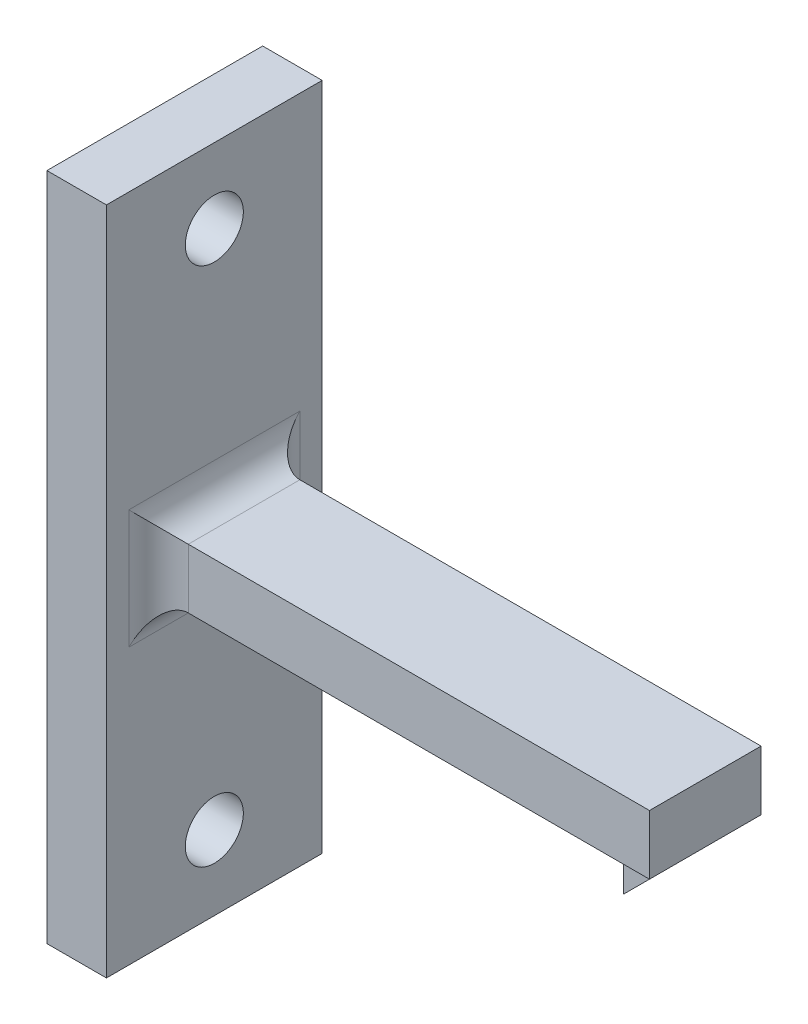
from build123d import *

# Parameters (mm, degrees)
BOSS_EXTRUDE1_DEPTH      = 1
BOSS_EXTRUDE1_DEPTH_BACK = 1
SKETCH2_R                = 2
SKETCH2_R_2              = 1
BOSS_EXTRUDE2_DEPTH      = 4
SKETCH4_R                = 1.07
CUT_EXTRUDE1_DEPTH       = 233.583689314
BOSS_EXTRUDE3_DEPTH      = 2
SKETCH8_W                = 4
SKETCH8_H                = 8
BOSS_EXTRUDE4_DEPTH      = 2
CUT_EXTRUDE2_DEPTH       = 2
SKETCH10_W               = 34.5
SKETCH10_H               = 4
BOSS_EXTRUDE5_DEPTH      = 2.75
SKETCH11_W               = 34.5
SKETCH11_H               = 4
BOSS_EXTRUDE6_DEPTH      = 2.75
BOSS_EXTRUDE7_DEPTH      = 0.5
BOSS_EXTRUDE8_DEPTH      = 0.5
SKETCH14_W               = 1.779922348
SKETCH14_H               = 4
BOSS_EXTRUDE9_DEPTH      = 7.5
CUT_EXTRUDE3_DEPTH       = 10
CUT_EXTRUDE3_DEPTH_BACK  = 2
SKETCH15_W               = 40
SKETCH15_H               = 27.31360861
SKETCH16_W               = 14.5
SKETCH16_H               = 45
BOSS_EXTRUDE10_DEPTH     = 4
SKETCH18_R               = 1.95
CUT_EXTRUDE4_DEPTH       = 4
FILLET1_R                = 2


with BuildPart() as part:
    # Sketch2 → Boss-Extrude1 (new, two sides: drawn at the far end of the back side and taken through both)
    # profile 1 of 2: a face of its own
    with BuildSketch(Plane.XY.offset(-2.5).offset(-BOSS_EXTRUDE1_DEPTH_BACK)):
        with BuildLine():
            ThreePointArc((230.02407749, -2), (228.02407749, 0), (230.02407749, 2))
            Line((230.02407749, 2), (225.02407749, 2))
            Line((225.02407749, 2), (225.02407749, -2))
            Line((225.02407749, -2), (230.02407749, -2))
        make_face()
    # profile 2 of 2: a face of its own
    with BuildSketch(Plane.XY.offset(-2.5).offset(-BOSS_EXTRUDE1_DEPTH_BACK)):
        with Locations((230.02407749, 0)):
            Circle(SKETCH2_R)
        with Locations((230.02407749, 0)):
            Circle(SKETCH2_R_2, mode=Mode.SUBTRACT)
    extrude(amount=BOSS_EXTRUDE1_DEPTH + BOSS_EXTRUDE1_DEPTH_BACK)

    # Sketch3 → Boss-Extrude2 (add)
    with BuildSketch(Plane(origin=(0, 2, 0), x_dir=(1, 0, 0), z_dir=(0, 1, 0))):
        Polygon((223.02407749, 2.5), (225.02407749, 2.5), (225.02407749, 3.5), (222.02407749, 10.5), (216.095506061, 10.5), (216.095506061, 8.5), (221.095506061, 8.5), (223.02407749, 4), align=None)
        Polygon((222.02407749, -5.5), (225.02407749, 1.5), (225.02407749, 2.5), (223.02407749, 2.5), (223.02407749, 1), (221.095506061, -3.5), (216.095506061, -3.5), (216.095506061, -5.5), align=None)
    extrude(amount=-BOSS_EXTRUDE2_DEPTH)

    # Sketch4 → Cut-Extrude1 (cut, through all)
    with BuildSketch(Plane(origin=(0, 0, -10.5), x_dir=(-1, 0, 0), z_dir=(0, 0, -1))):
        with Locations((-218.095506061, 0)):
            Circle(SKETCH4_R)
    extrude(amount=-CUT_EXTRUDE1_DEPTH, mode=Mode.SUBTRACT)

    # Sketch6 → Boss-Extrude3 (add)
    with BuildSketch(Plane.XY.offset(-1.5)):
        Polygon((230.02407749, 2), (258.02407749, 2), (258.02407749, -2), (230.02407749, -2), (228.102487775, -2), (228.102487775, 2), align=None)
    extrude(amount=-BOSS_EXTRUDE3_DEPTH)

    # Sketch8 → Boss-Extrude4 (add)
    with BuildSketch(Plane(origin=(0, 0, -3.5), x_dir=(-1, 0, 0), z_dir=(0, 0, -1))):
        with Locations((-256.02407749, -2)):
            Rectangle(SKETCH8_W, SKETCH8_H)
    extrude(amount=-BOSS_EXTRUDE4_DEPTH)

    # Sketch9 → Cut-Extrude2 (cut)
    with BuildSketch(Plane(origin=(0, 0, -3.5), x_dir=(-1, 0, 0), z_dir=(0, 0, -1))):
        Polygon((-254.02407749, -6), (-258.02407749, -6), (-258.02407749, -2), align=None)
    extrude(amount=-CUT_EXTRUDE2_DEPTH, mode=Mode.SUBTRACT)

    # Sketch10 → Boss-Extrude5 (add)
    with BuildSketch(Plane(origin=(0, 0, -3.5), x_dir=(-1, 0, 0), z_dir=(0, 0, -1))):
        with Locations((-240.77407749, 0)):
            Rectangle(SKETCH10_W, SKETCH10_H)
    extrude(amount=BOSS_EXTRUDE5_DEPTH)

    # Sketch11 → Boss-Extrude6 (add)
    with BuildSketch(Plane.XY.offset(-1.5)):
        with Locations((240.77407749, 0)):
            Rectangle(SKETCH11_W, SKETCH11_H)
    extrude(amount=BOSS_EXTRUDE6_DEPTH)

    # Sketch12 → Boss-Extrude7 (add)
    with BuildSketch(Plane(origin=(0, 0, -3.5), x_dir=(-1, 0, 0), z_dir=(0, 0, -1))):
        Polygon((-258.02407749, -2), (-254.02407749, -6), (-254.02407749, -2), align=None)
    extrude(amount=BOSS_EXTRUDE7_DEPTH)

    # Sketch13 → Boss-Extrude8 (add)
    with BuildSketch(Plane.XY.offset(-1.5)):
        Polygon((254.02407749, -2), (254.02407749, -6), (258.02407749, -2), align=None)
    extrude(amount=BOSS_EXTRUDE8_DEPTH)

    # Sketch14 → Boss-Extrude9 (add)
    with BuildSketch(Plane(origin=(0, 0, -6.25), x_dir=(-1, 0, 0), z_dir=(0, 0, -1))):
        with Locations((-223.914038664, 0)):
            Rectangle(SKETCH14_W, SKETCH14_H)
    extrude(amount=-BOSS_EXTRUDE9_DEPTH)

    # Sketch15 → Cut-Extrude3 (cut, two sides: drawn at the far end of the back side and taken through both)
    with BuildSketch(Plane.ZY.offset(-223.02407749).offset(-CUT_EXTRUDE3_DEPTH_BACK)):
        with Locations((-2.5, 0)):
            Rectangle(SKETCH15_W, SKETCH15_H)
    extrude(amount=CUT_EXTRUDE3_DEPTH + CUT_EXTRUDE3_DEPTH_BACK, mode=Mode.SUBTRACT)

    # Sketch16 → Boss-Extrude10 (add)
    with BuildSketch(Plane.ZY.offset(-225.02407749)):
        with Locations((-2.5, 0)):
            Rectangle(SKETCH16_W, SKETCH16_H)
    extrude(amount=BOSS_EXTRUDE10_DEPTH)

    # Sketch18 → Cut-Extrude4 (cut)
    with BuildSketch(Plane.ZY.offset(-221.02407749)):
        with Locations((-2.5, 17.5)):
            Circle(SKETCH18_R)
        with Locations((-2.5, -17.5)):
            Circle(SKETCH18_R)
    extrude(amount=-CUT_EXTRUDE4_DEPTH, mode=Mode.SUBTRACT)

    # Fillet1
    fillet1_edges = [part.edges().sort_by_distance(p)[0] for p in [
        (225.02407749, 0, 1.25),
        (225.02407749, 0, -6.25),
        (225.02407749, -2, -2.5),
        (225.02407749, 2, -2.5),
    ]]
    fillet(fillet1_edges, radius=FILLET1_R)


solid = part.part
